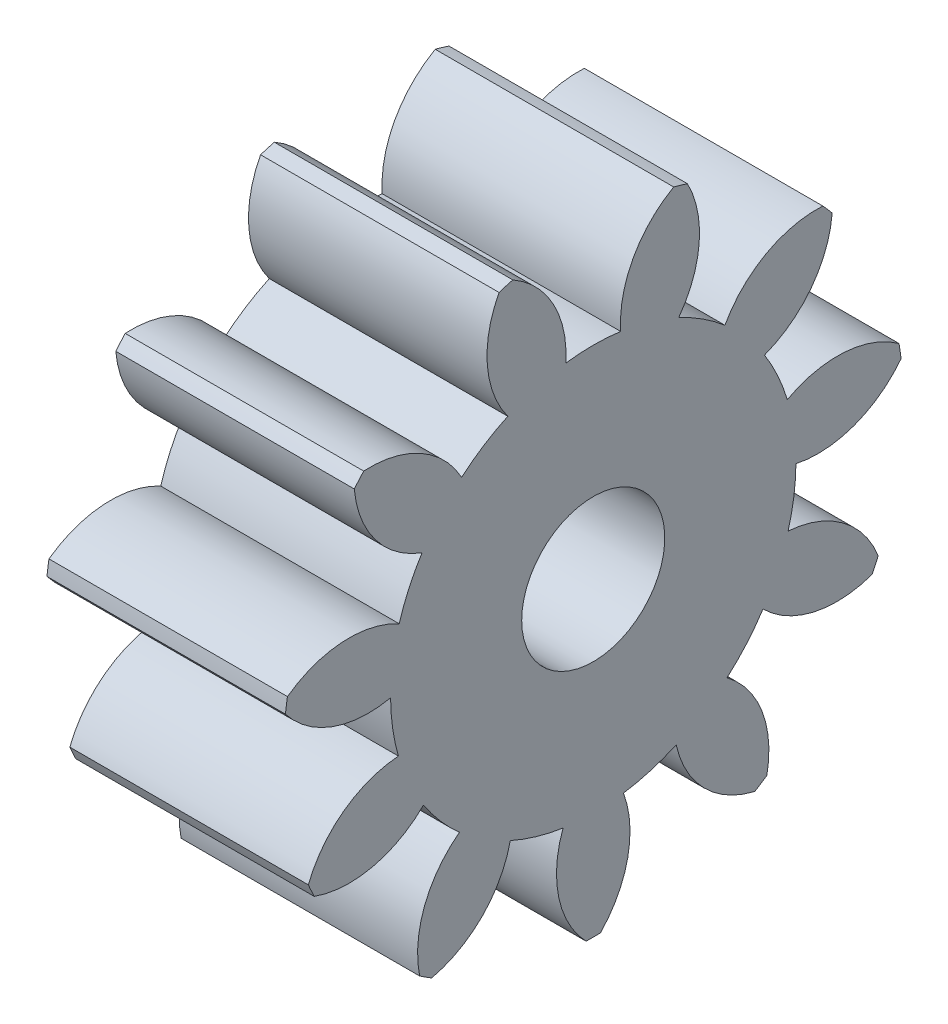
from build123d import *

# Parameters (mm, degrees)
BASPROSKE_W             = 5
BASPROSKE_H             = 6.5
TOOTHCUT_DEPTH          = 11.464224768
TEETHCUTS_COUNT         = 11
TEETHCUTS_ANGLE         = 327.272727273
BORSKE_R                = 1.5
BORE_DEPTH              = 50.0000508
ESQUISSE1_R             = 2.75
ENL_V_MAT_EXTRU_1_DEPTH = 3
ESQUISSE2_R             = 2.75
ESQUISSE2_R_2           = 1.5
BOSS_EXTRU_1_DEPTH      = 3
ENL_V_MAT_EXTRU_2_DEPTH = 2
BOSS_EXTRU_2_START      = -2
ESQUISSE4_R             = 3.301127001
ESQUISSE4_R_2           = 1.5
BOSS_EXTRU_2_DEPTH      = 2
ENL_V_MAT_EXTRU_3_DEPTH = 2.5


with BuildPart() as part:
    # BasProSke → Base-Revolve (revolve)
    with BuildSketch(Plane(origin=(0, 0, 0), x_dir=(1, 0, 0), z_dir=(0, 1, 0)), mode=Mode.PRIVATE) as base_revolve_sk:
        with Locations((2.5, 3.25)):
            Rectangle(BASPROSKE_W, BASPROSKE_H)
    revolve(base_revolve_sk.sketch.rotate(Axis((-10, 0, 0), (1, 0, 0)), 180), axis=Axis((-10, 0, 0), (1, 0, 0)))

    # TooCutSke → ToothCut (cut, through all)
    with BuildSketch(Plane(origin=(0, 0, 0), x_dir=(0, 0, -1), z_dir=(1, 0, 0))):
        with BuildLine():
            ThreePointArc((0.576045815, 4.209771041), (0, 4.249), (-0.576045815, 4.209771041))
            ThreePointArc((-0.576045815, 4.209771041), (-0.841371334, 5.420048739), (-1.718652745, 6.295004202))
            ThreePointArc((-1.718652745, 6.295004202), (0, 6.5254), (1.718652745, 6.295004202))
            ThreePointArc((1.718652745, 6.295004202), (0.841371334, 5.420048739), (0.576045815, 4.209771041))
        make_face()
    toothcut = extrude(amount=TOOTHCUT_DEPTH, mode=Mode.SUBTRACT)

    # TeethCuts: ToothCut ×11 about axis
    teethcuts_axis = Axis((-10, 0, 0), (1, 0, 0))
    for i in range(1, TEETHCUTS_COUNT):
        add(toothcut.rotate(teethcuts_axis, i * TEETHCUTS_ANGLE / (TEETHCUTS_COUNT - 1)), mode=Mode.SUBTRACT)

    # BorSke → Bore (cut, symmetric)
    with BuildSketch(Plane(origin=(0, 0, 0), x_dir=(0, 0, -1), z_dir=(1, 0, 0))):
        with Locations(Location((0, 0, 0), (0, 0, 180))):
            Circle(BORSKE_R)
    extrude(amount=BORE_DEPTH, both=True, mode=Mode.SUBTRACT)

    # Esquisse1 → Enlèv. mat.-Extru.1 (cut)
    with BuildSketch(Plane.ZY):
        Circle(ESQUISSE1_R)
    extrude(amount=-ENL_V_MAT_EXTRU_1_DEPTH, mode=Mode.SUBTRACT)

    # Esquisse2 → Boss.-Extru.1 (add)
    with BuildSketch(Plane.ZY.offset(-3)):
        Circle(ESQUISSE2_R)
        Circle(ESQUISSE2_R_2, mode=Mode.SUBTRACT)
    extrude(amount=BOSS_EXTRU_1_DEPTH)

    # Esquisse3 → Enlèv. mat.-Extru.2 (cut)
    with BuildSketch(Plane.ZY):
        Polygon((2.381429268, -2.186807713), (3.084545667, 0.968974387), (0.703116398, 3.1557821), (-2.381429268, 2.186807713), (-3.084545667, -0.968974387), (-0.703116398, -3.1557821), align=None)
    extrude(amount=-ENL_V_MAT_EXTRU_2_DEPTH, mode=Mode.SUBTRACT)

    # Esquisse4 → Boss.-Extru.2 (add)
    with BuildSketch(Plane.ZY.offset(BOSS_EXTRU_2_START)):
        Circle(ESQUISSE4_R)
        Circle(ESQUISSE4_R_2, mode=Mode.SUBTRACT)
    extrude(amount=BOSS_EXTRU_2_DEPTH)

    # Esquisse5 → Enlèv. mat.-Extru.3 (cut)
    with BuildSketch(Plane.ZY):
        with BuildLine():
            Line((-1.61510442, 2.41463511), (2.872559283, 0.432929749))
            ThreePointArc((2.872559283, 0.432929749), (-1.173493595, -2.657430673), (-1.61510442, 2.41463511))
        make_face()
    extrude(amount=-ENL_V_MAT_EXTRU_3_DEPTH, mode=Mode.SUBTRACT)


solid = part.part
